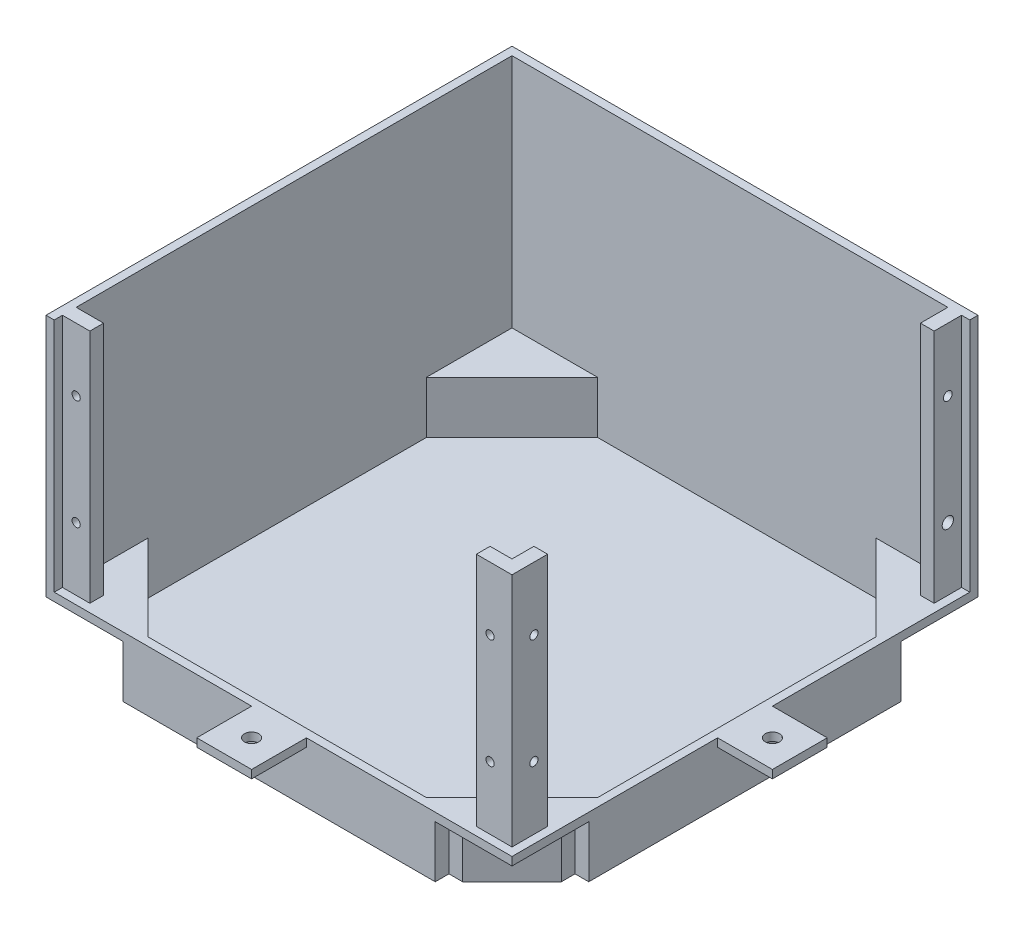
from build123d import *

# Parameters (mm, degrees)
EXTRUDE_1_DEPTH      = 4
EXTRUDE_2_DEPTH      = 16
SKETCH_3_W           = 170
SKETCH_3_H           = 170
CUT_EXTRUDE_2_DEPTH  = 1
EXTRUDE_3_DEPTH      = 3
EXTRUDE_4_DEPTH      = 86
SKETCH_7_W           = 10
SKETCH_7_H           = 3
SKETCH_7_W_2         = 3
SKETCH_7_H_2         = 10
EXTRUDE_6_DEPTH      = 86
SKETCH_8_R           = 1.5
CUT_EXTRUDE_3_DEPTH  = 86
SKETCH_9_R           = 1.606229087
SKETCH_9_R_2         = 2.055519853
CUT_EXTRUDE_4_DEPTH  = 86
SKETCH_10_W          = 3
SKETCH_10_H          = 3
EXTRUDE_7_DEPTH      = 86
SKETCH_11_R          = 1.5
CUT_EXTRUDE_5_DEPTH  = 86
EXTRUDE_8_DEPTH      = 86
SKETCH_13_R          = 1.5
CUT_EXTRUDE_6_DEPTH  = 86
SKETCH_14_R          = 3
CUT_EXTRUDE_7_DEPTH  = 2
SKETCH_15_R          = 1.5
CUT_EXTRUDE_8_DEPTH  = 5
SKETCH_16_R          = 3
CUT_EXTRUDE_9_DEPTH  = 2
SKETCH_17_W          = 10
SKETCH_17_H          = 2
SKETCH_17_W_2        = 2
SKETCH_17_H_2        = 10
EXTRUDE_9_DEPTH      = 86
SKETCH_18_R          = 3
CUT_EXTRUDE_10_DEPTH = 2
SKETCH_19_R          = 3
CUT_EXTRUDE_11_DEPTH = 2
SKETCH_22_W          = 20
SKETCH_22_H          = 20
SKETCH_22_R          = 2.6
EXTRUDE_10_DEPTH     = 3


with BuildPart() as part:
    # 草图1 → 凸台-拉伸1 (new body)
    with BuildSketch(Plane(origin=(0, 0, 0), x_dir=(1, 0, 0), z_dir=(0, 1, 0))):
        Polygon((-80, 62), (-62, 80), (-57, 80), (-57, 85), (57, 85), (57, 80), (62, 80), (80, 62), (80, 57), (85, 57), (85, -57), (80, -57), (80, -62), (62, -80), (57, -80), (57, -85), (-57, -85), (-57, -80), (-62, -80), (-80, -62), (-80, -57), (-85, -57), (-85, 57), (-80, 57), align=None)
    extrude(amount=EXTRUDE_1_DEPTH)

    # 草图2 → 凸台-拉伸2 (add)
    with BuildSketch(Plane(origin=(0, 4, 0), x_dir=(1, 0, 0), z_dir=(0, 1, 0))):
        Polygon((-57, 85), (57, 85), (57, 80), (62, 80), (80, 62), (80, 57), (85, 57), (85, -57), (80, -57), (80, -62), (62, -80), (57, -80), (57, -85), (-57, -85), (-57, -80), (-62, -80), (-80, -62), (-80, -57), (-85, -57), (-85, 57), (-80, 57), (-80, 62), (-62, 80), (-57, 80), align=None)
        Polygon((-82, 50.757359313), (-50.757359313, 82), (50.757359313, 82), (82, 50.757359313), (82, -50.757359313), (50.757359313, -82), (-50.757359313, -82), (-82, -50.757359313), align=None, mode=Mode.SUBTRACT)
    extrude(amount=EXTRUDE_2_DEPTH)

    # 草图3 → 切除-拉伸2 (cut)
    with BuildSketch(Plane(origin=(0, 0, 0), x_dir=(-1, 0, 0), z_dir=(0, -1, 0))):
        Rectangle(SKETCH_3_W, SKETCH_3_H)
    extrude(amount=-CUT_EXTRUDE_2_DEPTH, mode=Mode.SUBTRACT)

    # 草图4 → 凸台-拉伸3 (add)
    with BuildSketch(Plane(origin=(0, 20, 0), x_dir=(1, 0, 0), z_dir=(0, 1, 0))):
        Polygon((85, 85), (-57, 85), (-85, 85), (-85, -85), (57, -85), (85, -85), align=None)
        Polygon((82, 50.757359313), (82, -50.757359313), (50.757359313, -82), (-50.757359313, -82), (-82, -50.757359313), (-82, 50.757359313), (-50.757359313, 82), (50.757359313, 82), align=None, mode=Mode.SUBTRACT)
    extrude(amount=EXTRUDE_3_DEPTH)

    # 草图5 → 凸台-拉伸4 (add)
    with BuildSketch(Plane(origin=(0, 23, 0), x_dir=(1, 0, 0), z_dir=(0, 1, 0))):
        Polygon((85, 85), (-85, 85), (-85, -85), (-82, -85), (-82, 82), (85, 82), align=None)
    extrude(amount=EXTRUDE_4_DEPTH)

    # 草图7 → 凸台-拉伸6 (add)
    with BuildSketch(Plane(origin=(0, 23, 0), x_dir=(1, 0, 0), z_dir=(0, 1, 0))):
        with Locations((-77, -80.5)):
            Rectangle(SKETCH_7_W, SKETCH_7_H)
        with Locations((80.5, 77)):
            Rectangle(SKETCH_7_W_2, SKETCH_7_H_2)
        Polygon((72, -79), (72, -82), (82, -82), (82, -72), (79, -72), (79, -79), align=None)
    extrude(amount=EXTRUDE_6_DEPTH)

    # 草图8 → 切除-拉伸3 (cut)
    with BuildSketch(Plane.XY.offset(82)):
        with Locations((-77, 86)):
            Circle(SKETCH_8_R)
        with Locations((-77, 46)):
            Circle(SKETCH_8_R)
    extrude(amount=-CUT_EXTRUDE_3_DEPTH, mode=Mode.SUBTRACT)

    # 草图9 → 切除-拉伸4 (cut)
    with BuildSketch(Plane(origin=(82, 0, 0), x_dir=(0, 0, -1), z_dir=(1, 0, 0))):
        with Locations((77, 86)):
            Circle(SKETCH_9_R)
        with Locations((77, 46)):
            Circle(SKETCH_9_R_2)
    extrude(amount=-CUT_EXTRUDE_4_DEPTH, mode=Mode.SUBTRACT)

    # 草图10 → 凸台-拉伸7 (add)
    with BuildSketch(Plane(origin=(0, 109, 0), x_dir=(1, 0, 0), z_dir=(0, 1, 0))):
        with Locations((80.5, -70.5)):
            Rectangle(SKETCH_10_W, SKETCH_10_H)
        with Locations((70.5, -80.5)):
            Rectangle(SKETCH_10_W, SKETCH_10_H)
    extrude(amount=-EXTRUDE_7_DEPTH)

    # 草图11 → 切除-拉伸5 (cut)
    with BuildSketch(Plane.XY.offset(82)):
        with Locations((74, 86)):
            Circle(SKETCH_11_R)
        with Locations((74, 46)):
            Circle(SKETCH_11_R)
    extrude(amount=-CUT_EXTRUDE_5_DEPTH, mode=Mode.SUBTRACT)

    # 草图12 → 凸台-拉伸8 (add)
    with BuildSketch(Plane(origin=(0, 109, 0), x_dir=(1, 0, 0), z_dir=(0, 1, 0))):
        Polygon((69, -77), (69, -79), (79, -79), (79, -69), (77, -69), (77, -77), align=None)
    extrude(amount=-EXTRUDE_8_DEPTH)

    # 草图13 → 切除-拉伸6 (cut)
    with BuildSketch(Plane.XY.offset(82)):
        with Locations((74, 86)):
            Circle(SKETCH_13_R)
        with Locations((74, 46)):
            Circle(SKETCH_13_R)
    extrude(amount=-CUT_EXTRUDE_6_DEPTH, mode=Mode.SUBTRACT)

    # 草图14 → 切除-拉伸7 (cut)
    with BuildSketch(Plane(origin=(0, 0, 77), x_dir=(-1, 0, 0), z_dir=(0, 0, -1))):
        with Locations((-74, 86)):
            Circle(SKETCH_14_R)
        with Locations((-74, 46)):
            Circle(SKETCH_14_R)
    extrude(amount=-CUT_EXTRUDE_7_DEPTH, mode=Mode.SUBTRACT)

    # 草图15 → 切除-拉伸8 (cut)
    with BuildSketch(Plane(origin=(82, 0, 0), x_dir=(0, 0, -1), z_dir=(1, 0, 0))):
        with Locations((-74, 86)):
            Circle(SKETCH_15_R)
        with Locations((-74, 46)):
            Circle(SKETCH_15_R)
    extrude(amount=-CUT_EXTRUDE_8_DEPTH, mode=Mode.SUBTRACT)

    # 草图16 → 切除-拉伸9 (cut)
    with BuildSketch(Plane.ZY.offset(-77)):
        with Locations((74, 86)):
            Circle(SKETCH_16_R)
        with Locations((74, 46)):
            Circle(SKETCH_16_R)
    extrude(amount=-CUT_EXTRUDE_9_DEPTH, mode=Mode.SUBTRACT)

    # 草图17 → 凸台-拉伸9 (add)
    with BuildSketch(Plane(origin=(0, 109, 0), x_dir=(1, 0, 0), z_dir=(0, 1, 0))):
        with Locations((-77, -78)):
            Rectangle(SKETCH_17_W, SKETCH_17_H)
        with Locations((78, 77)):
            Rectangle(SKETCH_17_W_2, SKETCH_17_H_2)
    extrude(amount=-EXTRUDE_9_DEPTH)

    # 草图18 → 切除-拉伸10 (cut)
    with BuildSketch(Plane.ZY.offset(-77)):
        with Locations((-77, 86)):
            Circle(SKETCH_18_R)
        with Locations((-77, 46)):
            Circle(SKETCH_18_R)
    extrude(amount=-CUT_EXTRUDE_10_DEPTH, mode=Mode.SUBTRACT)

    # 草图19 → 切除-拉伸11 (cut)
    with BuildSketch(Plane(origin=(0, 0, 77), x_dir=(-1, 0, 0), z_dir=(0, 0, -1))):
        with Locations((77, 86)):
            Circle(SKETCH_19_R)
        with Locations((77, 46)):
            Circle(SKETCH_19_R)
    extrude(amount=-CUT_EXTRUDE_11_DEPTH, mode=Mode.SUBTRACT)

    # 草图22 → 凸台-拉伸10 (add)
    # profile 1 of 3: a face of its own
    with BuildSketch(Plane(origin=(0, 23, 0), x_dir=(1, 0, 0), z_dir=(0, 1, 0))):
        with Locations((-95, 10)):
            Rectangle(SKETCH_22_W, SKETCH_22_H)
        with Locations((-95, 10)):
            Circle(SKETCH_22_R, mode=Mode.SUBTRACT)
    # profile 2 of 3: a face of its own
    with BuildSketch(Plane(origin=(0, 23, 0), x_dir=(1, 0, 0), z_dir=(0, 1, 0))):
        with Locations((95, 0)):
            Rectangle(SKETCH_22_W, SKETCH_22_H)
        with Locations((95, 0)):
            Circle(SKETCH_22_R, mode=Mode.SUBTRACT)
    # profile 3 of 3: a face of its own
    with BuildSketch(Plane(origin=(0, 23, 0), x_dir=(1, 0, 0), z_dir=(0, 1, 0))):
        with Locations((0, -95)):
            Rectangle(SKETCH_22_W, SKETCH_22_H)
        with Locations((0, -95)):
            Circle(SKETCH_22_R, mode=Mode.SUBTRACT)
    extrude(amount=-EXTRUDE_10_DEPTH)


solid = part.part
